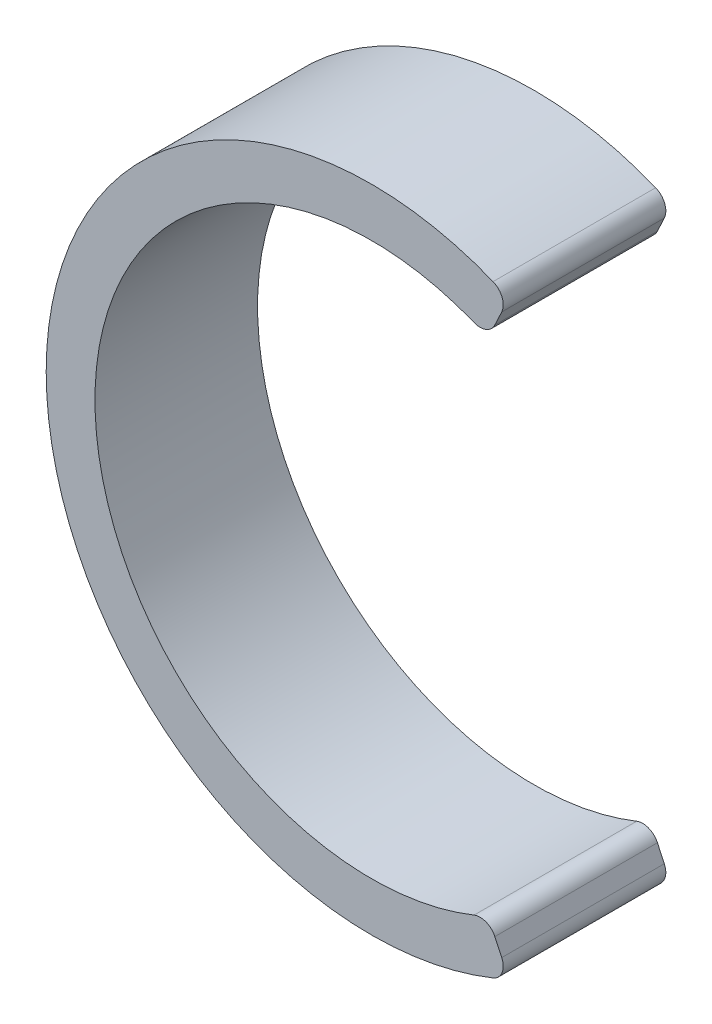
from build123d import *

# Parameters (mm, degrees)
BOSS_EXTRUDE1_DEPTH = 10


with BuildPart() as part:
    # Sketch1 → Boss-Extrude1 (new body)
    with BuildSketch(Plane.XY):
        with BuildLine():
            Line((7.595380243, 16.288345495), (8.018617727, 17.195981209))
            ThreePointArc((8.018617727, 17.195981209), (8.04267325, 17.98523841), (7.486642042, 18.54589418))
            ThreePointArc((7.486642042, 18.54589418), (-20, 0), (7.486642042, -18.54589418))
            ThreePointArc((7.486642042, -18.54589418), (8.04267325, -17.98523841), (8.018617727, -17.195981209))
            Line((8.018617727, -17.195981209), (7.595380243, -16.288345495))
            ThreePointArc((7.595380243, -16.288345495), (7.057073176, -15.781138252), (6.31745732, -15.782576881))
            ThreePointArc((6.31745732, -15.782576881), (-17, 0), (6.31745732, 15.782576881))
            ThreePointArc((6.31745732, 15.782576881), (7.057073176, 15.781138252), (7.595380243, 16.288345495))
        make_face()
    extrude(amount=BOSS_EXTRUDE1_DEPTH)


solid = part.part
